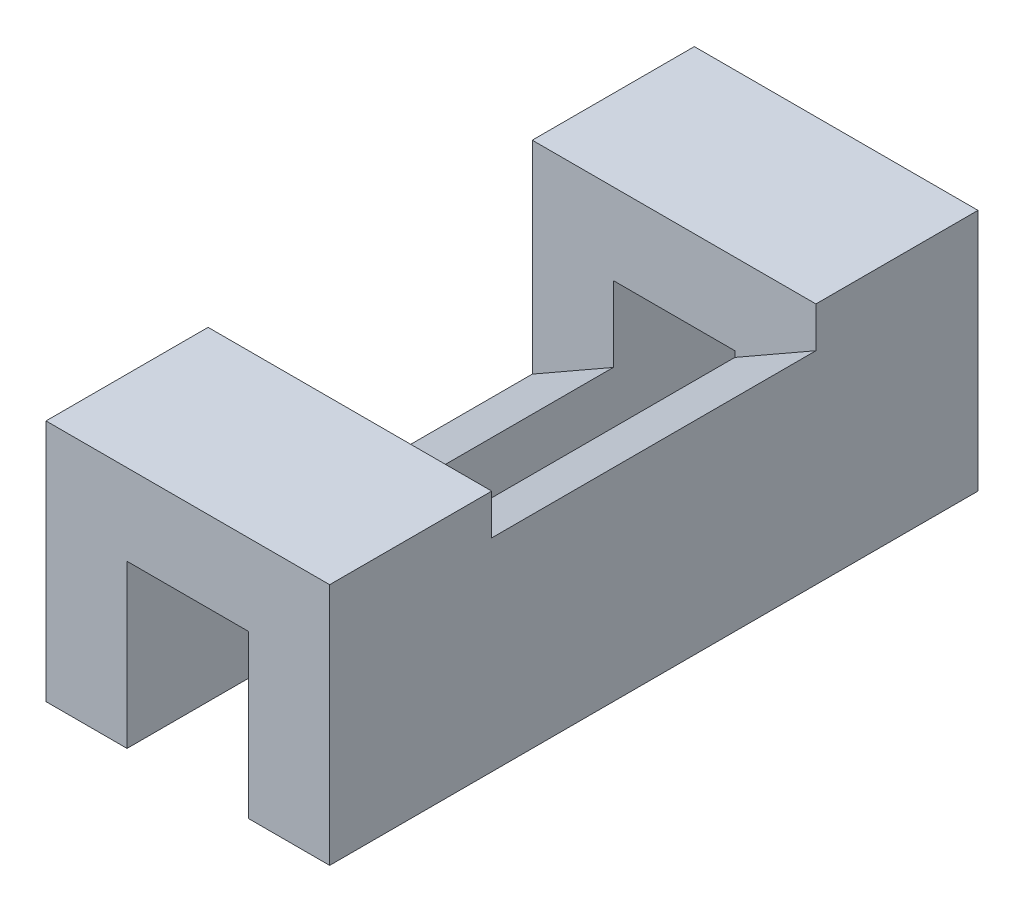
from build123d import *

# Parameters (mm, degrees)
BOSS_EXTRUDE1_DEPTH = 80
CUT_EXTRUDE1_DEPTH  = 60
BOSS_EXTRUDE2_DEPTH = 20


with BuildPart() as part:
    # Sketch1 → Boss-Extrude1 (new body)
    with BuildSketch(Plane.XY):
        Polygon((-35, 0), (-25, 0), (-25, 20), (-10, 20), (-10, 0), (0, 0), (0, 30), (-35, 30), align=None)
    extrude(amount=BOSS_EXTRUDE1_DEPTH)

    # Sketch2 → Cut-Extrude1 (cut)
    with BuildSketch(Plane.XY.offset(80)):
        Polygon((0, 25), (0, 30), (-35, 30), (-35, 5), (-25, 10.714285714), (-25, 20), (-10, 20), (-10, 19.285714286), align=None)
    extrude(amount=-CUT_EXTRUDE1_DEPTH, mode=Mode.SUBTRACT)

    # Sketch2<2> → Boss-Extrude2 (add)
    with BuildSketch(Plane.XY.offset(80)):
        Polygon((0, 25), (0, 30), (-35, 30), (-35, 5), (-25, 10.714285714), (-25, 20), (-10, 20), (-10, 19.285714286), align=None)
    extrude(amount=-BOSS_EXTRUDE2_DEPTH)


solid = part.part
